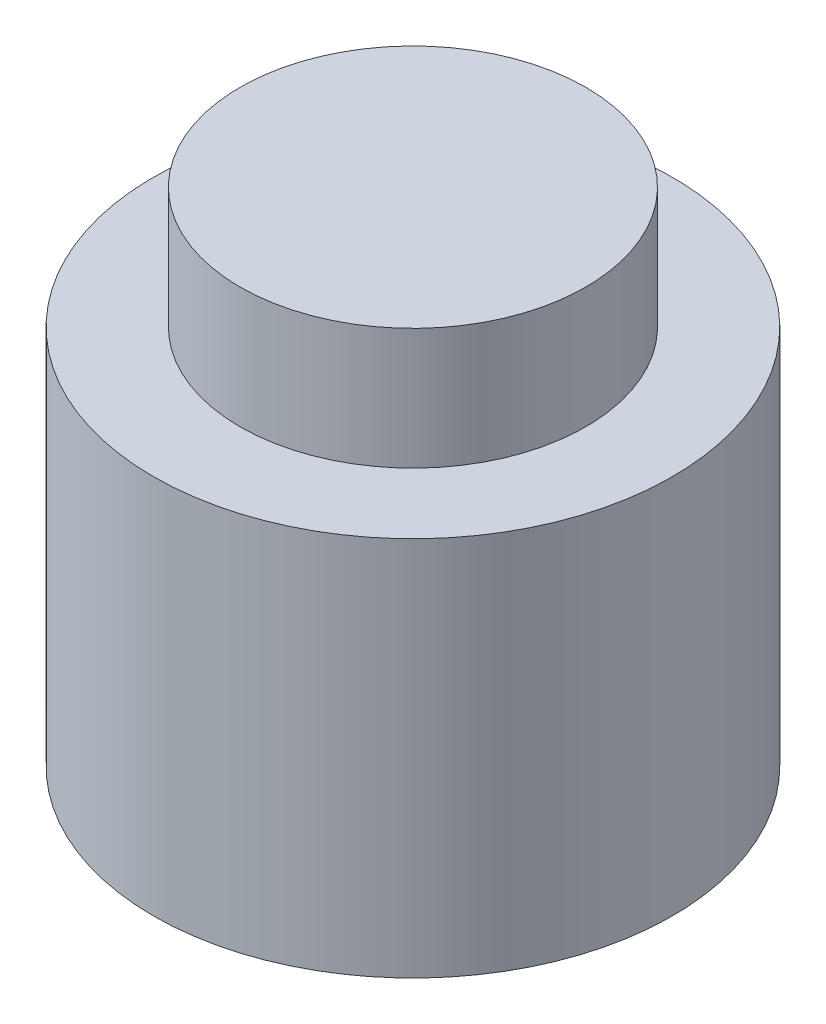
from build123d import *

# Parameters (mm, degrees)
SKETCH1_R           = 15
BOSS_EXTRUDE1_DEPTH = 22
SKETCH2_R           = 10
BOSS_EXTRUDE2_DEPTH = 7


with BuildPart() as part:
    # Sketch1 → Boss-Extrude1 (new body)
    with BuildSketch(Plane(origin=(0, 0, 0), x_dir=(1, 0, 0), z_dir=(0, 1, 0))):
        with Locations(Location((0, 0, 0), (0, 0, 270))):
            Circle(SKETCH1_R)
    extrude(amount=BOSS_EXTRUDE1_DEPTH)

    # Sketch2 → Boss-Extrude2 (add)
    with BuildSketch(Plane(origin=(0, 22, 0), x_dir=(1, 0, 0), z_dir=(0, 1, 0))):
        with Locations(Location((0, 0, 0), (0, 0, 270))):
            Circle(SKETCH2_R)
    extrude(amount=BOSS_EXTRUDE2_DEPTH)


solid = part.part
